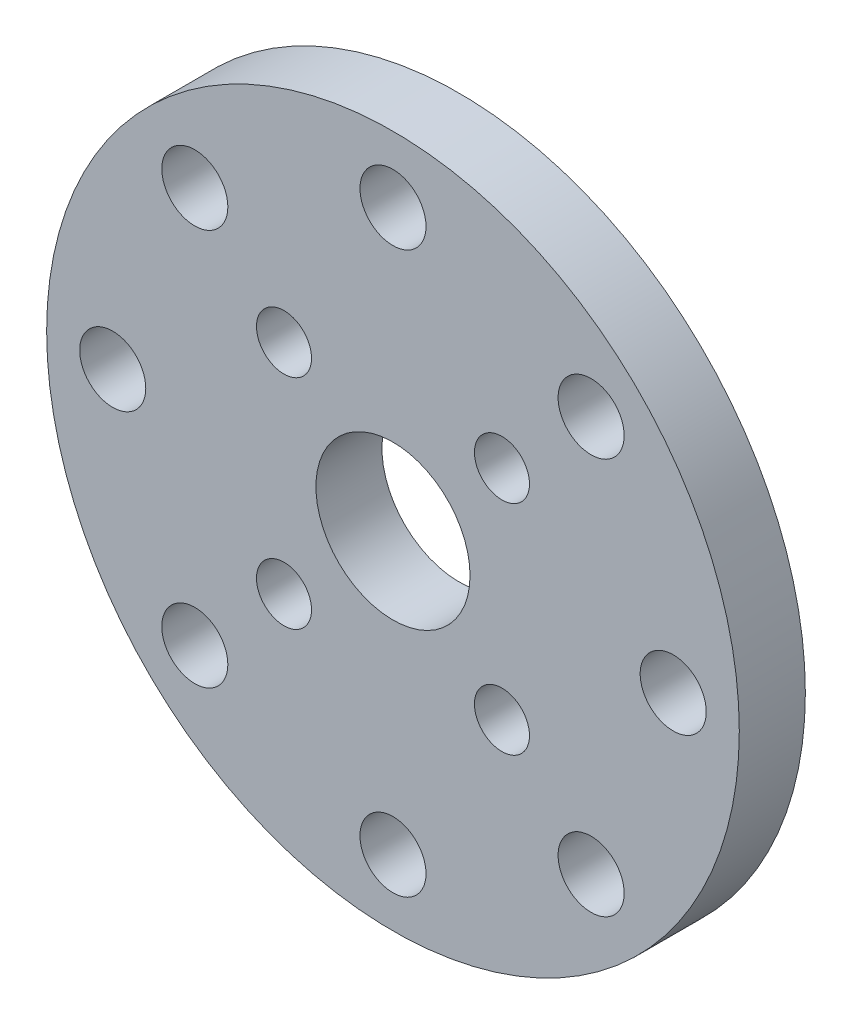
from build123d import *

# Parameters (mm, degrees)
MODEL_R                 = 15.73
MODEL_R_2               = 1.5
MODEL_R_3               = 1.25
MODEL_R_4               = 3.5
SALIENTE_EXTRUIR1_DEPTH = 3


with BuildPart() as part:
    # Model → Saliente-Extruir1 (new body)
    with BuildSketch(Plane.XY):
        with Locations((20.246400491, 284.547476206)):
            Circle(MODEL_R)
        with Locations((20.246400491, 297.275398267)):
            Circle(MODEL_R_2, mode=Mode.SUBTRACT)
        with Locations((7.51847843, 284.547476206)):
            Circle(MODEL_R_2, mode=Mode.SUBTRACT)
        with Locations((20.246400491, 271.819554144)):
            Circle(MODEL_R_2, mode=Mode.SUBTRACT)
        with Locations((32.974322552, 284.547476206)):
            Circle(MODEL_R_2, mode=Mode.SUBTRACT)
        with Locations((15.296653023, 289.497223674)):
            Circle(MODEL_R_3, mode=Mode.SUBTRACT)
        with Locations((15.296653023, 279.597728738)):
            Circle(MODEL_R_3, mode=Mode.SUBTRACT)
        with Locations((25.196147959, 279.597728738)):
            Circle(MODEL_R_3, mode=Mode.SUBTRACT)
        with Locations((25.196147959, 289.497223674)):
            Circle(MODEL_R_3, mode=Mode.SUBTRACT)
        with Locations((20.246400491, 284.547476206)):
            Circle(MODEL_R_4, mode=Mode.SUBTRACT)
        with Locations((11.246400491, 293.547476206)):
            Circle(MODEL_R_2, mode=Mode.SUBTRACT)
        with Locations((11.246400491, 275.547476206)):
            Circle(MODEL_R_2, mode=Mode.SUBTRACT)
        with Locations((29.246400491, 275.547476206)):
            Circle(MODEL_R_2, mode=Mode.SUBTRACT)
        with Locations((29.246400491, 293.547476206)):
            Circle(MODEL_R_2, mode=Mode.SUBTRACT)
    extrude(amount=SALIENTE_EXTRUIR1_DEPTH)


solid = part.part
